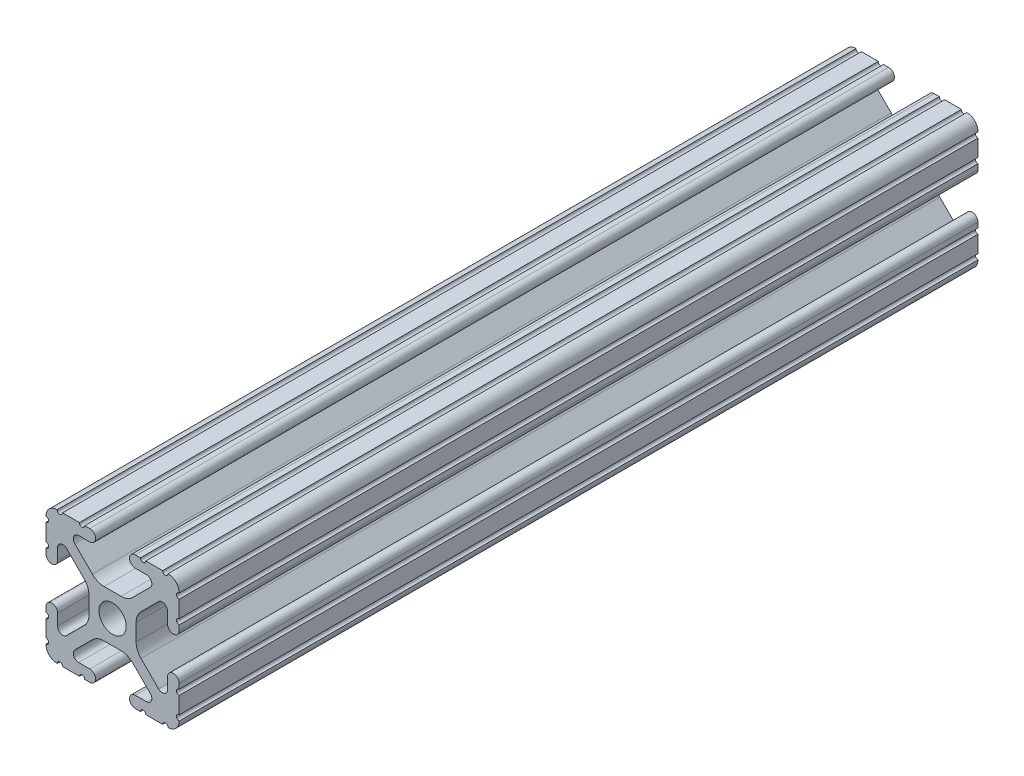
from build123d import *

# Parameters (mm, degrees)
SKETCH1_R           = 2.6035
BOSS_EXTRUDE1_DEPTH = 152.4


with BuildPart() as part:
    # Sketch1 → Boss-Extrude1 (new body)
    with BuildSketch(Plane(origin=(0, 0, -25.4), x_dir=(-1, 0, 0), z_dir=(0, 0, -1))):
        with BuildLine():
            Line((12.7, -9.5504), (12.7, -6.3330836))
            ThreePointArc((12.7, -6.3330836), (12.192, -5.8250836), (12.7, -5.3170836))
            Line((12.7, -5.3170836), (12.7, -4.3434))
            ThreePointArc((12.7, -4.3434), (11.5951, -3.2385), (10.4902, -4.3434))
            Line((10.4902, -4.3434), (10.4902, -6.474794456))
            ThreePointArc((10.4902, -6.474794456), (9.863006367, -7.413456061), (8.75577951, -7.193214945))
            Line((8.75577951, -7.193214945), (5.42573597, -3.863171405))
            ThreePointArc((5.42573597, -3.863171405), (4.737482484, -2.833127272), (4.4958, -1.618107374))
            Line((4.4958, -1.618107374), (4.4958, 1.618107374))
            ThreePointArc((4.4958, 1.618107374), (4.737482484, 2.833127272), (5.42573597, 3.863171405))
            Line((5.42573597, 3.863171405), (8.75577951, 7.193214945))
            ThreePointArc((8.75577951, 7.193214945), (9.863006367, 7.413456061), (10.4902, 6.474794456))
            Line((10.4902, 6.474794456), (10.4902, 4.343399971))
            ThreePointArc((10.4902, 4.343399971), (11.5951, 3.238499971), (12.7, 4.343399971))
            Line((12.7, 4.343399971), (12.7, 5.3170836))
            ThreePointArc((12.7, 5.3170836), (12.192, 5.8250836), (12.7, 6.3330836))
            Line((12.7, 6.3330836), (12.7, 9.5504))
            ThreePointArc((12.7, 9.5504), (12.192000006, 10.058323491), (12.699846982, 10.566399977))
            ThreePointArc((12.699846982, 10.566399977), (12.082522516, 12.082522516), (10.566399977, 12.699846982))
            ThreePointArc((10.566399977, 12.699846982), (10.058323491, 12.192000006), (9.5504, 12.7))
            Line((9.5504, 12.7), (6.3330836, 12.7))
            ThreePointArc((6.3330836, 12.7), (5.8250836, 12.192), (5.3170836, 12.7))
            Line((5.3170836, 12.7), (4.3434, 12.7))
            ThreePointArc((4.3434, 12.7), (3.2385, 11.5951), (4.3434, 10.4902))
            Line((4.3434, 10.4902), (6.474794456, 10.4902))
            ThreePointArc((6.474794456, 10.4902), (7.413456061, 9.863006367), (7.193214945, 8.75577951))
            Line((7.193214945, 8.75577951), (3.863171405, 5.42573597))
            ThreePointArc((3.863171405, 5.42573597), (2.833127272, 4.737482484), (1.618107374, 4.4958))
            Line((1.618107374, 4.4958), (-1.618107374, 4.4958))
            ThreePointArc((-1.618107374, 4.4958), (-2.833127272, 4.737482484), (-3.863171405, 5.42573597))
            Line((-3.863171405, 5.42573597), (-7.193214945, 8.75577951))
            ThreePointArc((-7.193214945, 8.75577951), (-7.413456061, 9.863006367), (-6.474794456, 10.4902))
            Line((-6.474794456, 10.4902), (-4.343399971, 10.4902))
            ThreePointArc((-4.343399971, 10.4902), (-3.238499971, 11.5951), (-4.343399971, 12.7))
            Line((-4.343399971, 12.7), (-5.3170836, 12.7))
            ThreePointArc((-5.3170836, 12.7), (-5.8250836, 12.192), (-6.3330836, 12.7))
            Line((-6.3330836, 12.7), (-9.5504, 12.7))
            ThreePointArc((-9.5504, 12.7), (-10.058323491, 12.192000006), (-10.566399977, 12.699846982))
            ThreePointArc((-10.566399977, 12.699846982), (-12.082522516, 12.082522516), (-12.699846982, 10.566399977))
            ThreePointArc((-12.699846982, 10.566399977), (-12.192000006, 10.058323491), (-12.7, 9.5504))
            Line((-12.7, 9.5504), (-12.7, 6.3330836))
            ThreePointArc((-12.7, 6.3330836), (-12.192, 5.8250836), (-12.7, 5.3170836))
            Line((-12.7, 5.3170836), (-12.7, 4.3434))
            ThreePointArc((-12.7, 4.3434), (-11.5951, 3.2385), (-10.4902, 4.3434))
            Line((-10.4902, 4.3434), (-10.4902, 6.474794456))
            ThreePointArc((-10.4902, 6.474794456), (-9.863006367, 7.413456061), (-8.75577951, 7.193214945))
            Line((-8.75577951, 7.193214945), (-5.42573597, 3.863171405))
            ThreePointArc((-5.42573597, 3.863171405), (-4.737482484, 2.833127272), (-4.4958, 1.618107374))
            Line((-4.4958, 1.618107374), (-4.4958, -1.618107374))
            ThreePointArc((-4.4958, -1.618107374), (-4.737482484, -2.833127272), (-5.42573597, -3.863171405))
            Line((-5.42573597, -3.863171405), (-8.75577951, -7.193214945))
            ThreePointArc((-8.75577951, -7.193214945), (-9.863006367, -7.413456061), (-10.4902, -6.474794456))
            Line((-10.4902, -6.474794456), (-10.4902, -4.343399971))
            ThreePointArc((-10.4902, -4.343399971), (-11.5951, -3.238499971), (-12.7, -4.343399971))
            Line((-12.7, -4.343399971), (-12.7, -5.3170836))
            ThreePointArc((-12.7, -5.3170836), (-12.192, -5.8250836), (-12.7, -6.3330836))
            Line((-12.7, -6.3330836), (-12.7, -9.5504))
            ThreePointArc((-12.7, -9.5504), (-12.192000006, -10.058323491), (-12.699846982, -10.566399977))
            ThreePointArc((-12.699846982, -10.566399977), (-12.082522516, -12.082522516), (-10.566399977, -12.699846982))
            ThreePointArc((-10.566399977, -12.699846982), (-10.058323491, -12.192000006), (-9.5504, -12.7))
            Line((-9.5504, -12.7), (-6.3330836, -12.7))
            ThreePointArc((-6.3330836, -12.7), (-5.8250836, -12.192), (-5.3170836, -12.7))
            Line((-5.3170836, -12.7), (-4.3434, -12.7))
            ThreePointArc((-4.3434, -12.7), (-3.2385, -11.5951), (-4.3434, -10.4902))
            Line((-4.3434, -10.4902), (-6.474794456, -10.4902))
            ThreePointArc((-6.474794456, -10.4902), (-7.413456061, -9.863006367), (-7.193214945, -8.75577951))
            Line((-7.193214945, -8.75577951), (-3.863171405, -5.42573597))
            ThreePointArc((-3.863171405, -5.42573597), (-2.833127272, -4.737482484), (-1.618107374, -4.4958))
            Line((-1.618107374, -4.4958), (1.618107374, -4.4958))
            ThreePointArc((1.618107374, -4.4958), (2.833127272, -4.737482484), (3.863171405, -5.42573597))
            Line((3.863171405, -5.42573597), (7.193214945, -8.75577951))
            ThreePointArc((7.193214945, -8.75577951), (7.413456061, -9.863006367), (6.474794456, -10.4902))
            Line((6.474794456, -10.4902), (4.343399971, -10.4902))
            ThreePointArc((4.343399971, -10.4902), (3.238499971, -11.5951), (4.343399971, -12.7))
            Line((4.343399971, -12.7), (5.3170836, -12.7))
            ThreePointArc((5.3170836, -12.7), (5.8250836, -12.192), (6.3330836, -12.7))
            Line((6.3330836, -12.7), (9.5504, -12.7))
            ThreePointArc((9.5504, -12.7), (10.058323491, -12.192000006), (10.566399977, -12.699846982))
            ThreePointArc((10.566399977, -12.699846982), (12.082522516, -12.082522516), (12.699846982, -10.566399977))
            ThreePointArc((12.699846982, -10.566399977), (12.192000006, -10.058323491), (12.7, -9.5504))
        make_face()
        with Locations(Location((0, 0, 0), (0, 0, 180))):
            Circle(SKETCH1_R, mode=Mode.SUBTRACT)
    extrude(amount=BOSS_EXTRUDE1_DEPTH)


solid = part.part
